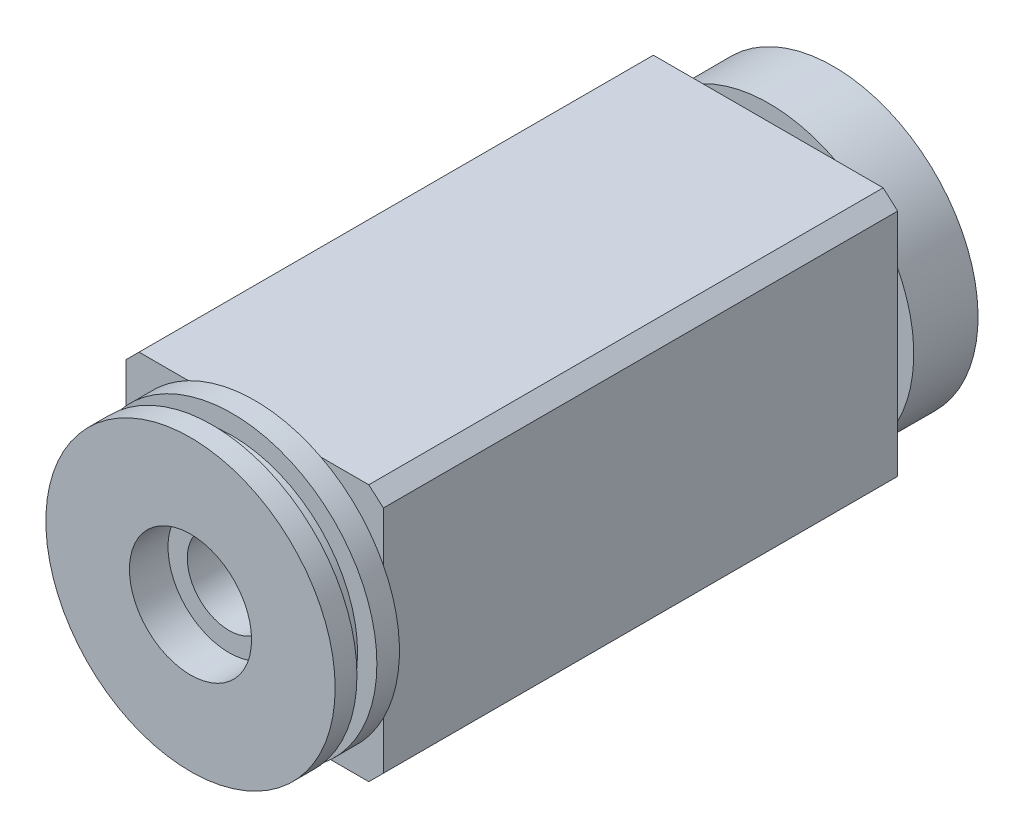
from build123d import *

# Parameters (mm, degrees)
EXTRUDE_1_DEPTH     = 80
SKETCH_3_R          = 22.5
EXTRUDE_2_DEPTH     = 10
EXTRUDE_START       = 10
SKETCH_4_R          = 22.5
EXTRUDE_3_DEPTH     = 10
SKETCH_6_R          = 9.5
CUT_EXTRUDE_3_DEPTH = 6
CUT_EXTRUDE_START   = -6
SKETCH_7_R          = 9.5
CUT_EXTRUDE_4_DEPTH = 6
SKETCH_8_R          = 6.5
CUT_EXTRUDE_5_DEPTH = 100
CUT_EXTRUDE_START_2 = -6.49
SKETCH_9_R          = 22.5
SKETCH_9_R_2        = 19.5
CUT_EXTRUDE_7_DEPTH = 3.1


with BuildPart() as part:
    # 草图1 → 凸台-拉伸1 (new body)
    with BuildSketch(Plane.XY):
        Polygon((-20, 18), (-18, 20), (17.735809733, 20), (20, 18), (20, -17.735809733), (17.735809733, -20), (-18, -20), (-20, -18), align=None)
    extrude(amount=EXTRUDE_1_DEPTH)

    # 草图3 → 凸台-拉伸2 (add)
    with BuildSketch(Plane.XY.offset(80)):
        with Locations(Location((0, 0, 0), (0, 0, 152.733955549))):
            Circle(SKETCH_3_R)
    extrude(amount=EXTRUDE_2_DEPTH)

    # 草图4 → 凸台-拉伸3 (add)
    with BuildSketch(Plane(origin=(0, 0, 0), x_dir=(-1, 0, 0), z_dir=(0, 0, -1)).offset(EXTRUDE_START)):
        with Locations(Location((0, 0, 0), (0, 0, 27.266044451))):
            Circle(SKETCH_4_R)
    extrude(amount=-EXTRUDE_3_DEPTH)

    # 草图6 → 切除-拉伸3 (cut)
    with BuildSketch(Plane(origin=(0, 0, -10), x_dir=(-1, 0, 0), z_dir=(0, 0, -1))):
        Circle(SKETCH_6_R)
    extrude(amount=-CUT_EXTRUDE_3_DEPTH, mode=Mode.SUBTRACT)

    # 草图7 → 切除-拉伸4 (cut)
    with BuildSketch(Plane.XY.offset(90).offset(CUT_EXTRUDE_START)):
        with Locations(Location((0, 0, 0), (0, 0, 180))):
            Circle(SKETCH_7_R)
    extrude(amount=CUT_EXTRUDE_4_DEPTH, mode=Mode.SUBTRACT)

    # 草图8 → 切除-拉伸5 (cut)
    with BuildSketch(Plane(origin=(0, 0, -10), x_dir=(-1, 0, 0), z_dir=(0, 0, -1))):
        Circle(SKETCH_8_R)
    extrude(amount=-CUT_EXTRUDE_5_DEPTH, mode=Mode.SUBTRACT)

    # 草图9 → 切除-拉伸7 (cut)
    with BuildSketch(Plane.XY.offset(90).offset(CUT_EXTRUDE_START_2)):
        with Locations(Location((0, 0, 0), (0, 0, 152.733955549))):
            Circle(SKETCH_9_R)
        Circle(SKETCH_9_R_2, mode=Mode.SUBTRACT)
    extrude(amount=CUT_EXTRUDE_7_DEPTH, mode=Mode.SUBTRACT)


solid = part.part
